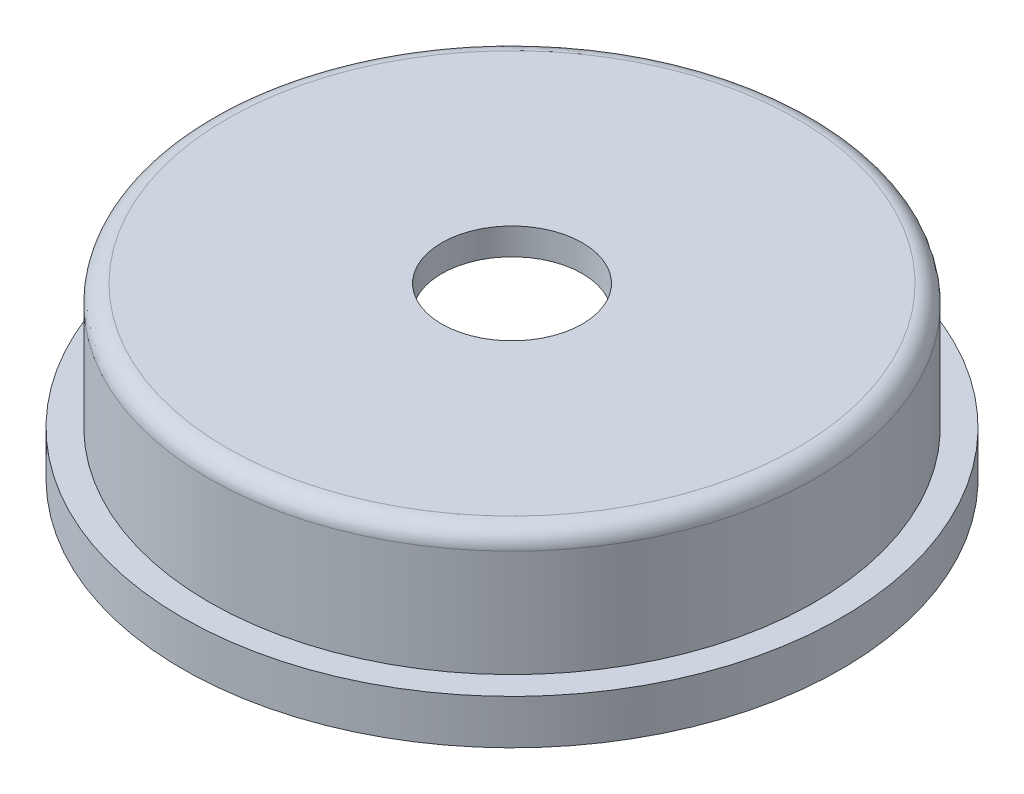
from build123d import *
from build123d.topology import SkipClean

# Parameters (mm, degrees)
SKETCH_1_R          = 18.5
EXTRUDE_1_DEPTH     = 20
SKETCH_2_R          = 16
CUT_EXTRUDE_1_DEPTH = 6.5
SKETCH_3_R          = 3.95
CUT_EXTRUDE_2_DEPTH = 7
SKETCH_4_R          = 3
CUT_EXTRUDE_3_DEPTH = 17
SKETCH_5_R          = 25.146051565
SKETCH_5_R_2        = 17
CUT_EXTRUDE_4_DEPTH = 19
CUT_EXTRUDE_5_DEPTH = 12
FILLET_5_R          = 1
FILLET_7_R          = 2
CUT_EXTRUDE_6_REACH = 34.932
SKETCH_9_R          = 5.408326913
SKETCH_9_R_2        = 4.5
FILLET_8_R          = 0.8
EXTRUDE_START       = 1.5
SKETCH_10_R         = 18.5
SKETCH_10_R_2       = 16
EXTRUDE_2_DEPTH     = 1.5
SKETCH_11_R         = 16
CUT_EXTRUDE_7_DEPTH = 29.783675929


with BuildPart() as part:
    # 草图1 → 凸台-拉伸1 (new body)
    with BuildSketch(Plane(origin=(0, 0, 0), x_dir=(1, 0, 0), z_dir=(0, 1, 0))):
        with Locations(Location((0, 0, 0), (0, 0, 270))):
            Circle(SKETCH_1_R)
    extrude(amount=EXTRUDE_1_DEPTH)

    # 草图2 → 切除-拉伸1 (cut)
    with BuildSketch(Plane.XZ):
        with Locations(Location((0, 0, 0), (0, 0, 270))):
            Circle(SKETCH_2_R)
    extrude(amount=-CUT_EXTRUDE_1_DEPTH, mode=Mode.SUBTRACT)

    # 草图3 → 切除-拉伸2 (cut)
    with BuildSketch(Plane.XZ.offset(-6.5)):
        with Locations(Location((0, 0, 0), (0, 0, 270))):
            Circle(SKETCH_3_R)
    extrude(amount=-CUT_EXTRUDE_2_DEPTH, mode=Mode.SUBTRACT)

    # 草图4 → 切除-拉伸3 (cut)
    with BuildSketch(Plane.XZ.offset(-13.5)):
        with Locations(Location((0, 0, 0), (0, 0, 270))):
            Circle(SKETCH_4_R)
    extrude(amount=-CUT_EXTRUDE_3_DEPTH, mode=Mode.SUBTRACT)

    # 草图5 → 切除-拉伸4 (cut)
    with BuildSketch(Plane(origin=(0, 20, 0), x_dir=(1, 0, 0), z_dir=(0, 1, 0))):
        Circle(SKETCH_5_R)
        with Locations(Location((0, 0, 0), (0, 0, 270))):
            Circle(SKETCH_5_R_2, mode=Mode.SUBTRACT)
    extrude(amount=-CUT_EXTRUDE_4_DEPTH, mode=Mode.SUBTRACT)

    # 草图6 → 切除-拉伸5 (cut)
    with BuildSketch(Plane(origin=(0, 20, 0), x_dir=(1, 0, 0), z_dir=(0, 1, 0))):
        with BuildLine():
            Line((-1, 15.467708298), (-1, 5.408326913))
            ThreePointArc((-1, 5.408326913), (-3.889087297, 3.889087297), (-5.408326913, 1))
            Line((-5.408326913, 1), (-15.467708298, 1))
            ThreePointArc((-15.467708298, 1), (-10.960155108, 10.960155108), (-1, 15.467708298))
        make_face()
        with BuildLine():
            Line((1, 15.467708298), (1, 5.408326913))
            ThreePointArc((1, 5.408326913), (3.889087297, 3.889087297), (5.408326913, 1))
            Line((5.408326913, 1), (15.467708298, 1))
            ThreePointArc((15.467708298, 1), (10.960155108, 10.960155108), (1, 15.467708298))
        make_face()
        with BuildLine():
            Line((-15.467708298, -1), (-5.408326913, -1))
            ThreePointArc((-5.408326913, -1), (-3.889087297, -3.889087297), (-1, -5.408326913))
            Line((-1, -5.408326913), (-1, -15.467708298))
            ThreePointArc((-1, -15.467708298), (-10.960155108, -10.960155108), (-15.467708298, -1))
        make_face()
        with BuildLine():
            Line((1, -5.408326913), (1, -15.467708298))
            ThreePointArc((1, -15.467708298), (10.960155108, -10.960155108), (15.467708298, -1))
            Line((15.467708298, -1), (5.408326913, -1))
            ThreePointArc((5.408326913, -1), (3.889087297, -3.889087297), (1, -5.408326913))
        make_face()
    extrude(amount=-CUT_EXTRUDE_5_DEPTH, mode=Mode.SUBTRACT)

    # 草图8 → 切除-旋转2 (revolve, cut)
    with BuildSketch(Plane.XY, mode=Mode.PRIVATE) as cut_revolve_2_sk:
        Polygon((-19.272016982, 8), (-19.272016982, 20.821833332), (-5.408326913, 20.821833332), (-5.408326913, 16), (-15, 8), (-17, 8), align=None)
    revolve(cut_revolve_2_sk.sketch.rotate(Axis((0, 13.5, 0), (0, -1, 0)), 270), axis=Axis((0, 13.5, 0), (0, -1, 0)), mode=Mode.SUBTRACT)

    # 圆角5
    fillet_5_edges = [part.edges().sort_by_distance(p)[0] for p in [
        (0, 8, -17),
    ]]
    fillet(fillet_5_edges, radius=FILLET_5_R)

    # 圆角7
    fillet_7_edges = [part.edges().sort_by_distance(p)[0] for p in [
        (-1, 11.96176972, 5.408326913),
        (-5.408326913, 11.96176972, 1),
        (-5.408326913, 11.96176972, -1),
        (-1, 11.96176972, -5.408326913),
        (1, 11.96176972, -5.408326913),
        (5.408326913, 11.96176972, -1),
        (5.408326913, 11.96176972, 1),
        (1, 11.96176972, 5.408326913),
    ]]
    fillet(fillet_7_edges, radius=FILLET_7_R)

    # 切除-拉伸6: up to this cone (the profile starts outside it)
    with SkipClean():  # the faces are left unmerged after this step: merging them gives an invalid solid
        cut_extrude_6_end = Plane(origin=(0, 20, 0), z_dir=(0, -1, 0)).offset(-0.510850748) * Cone(1.199e-06, 43.828361396, 36.555341117, align=(Align.CENTER, Align.CENTER, Align.MIN), mode=Mode.PRIVATE)
        # 草图9 → 切除-拉伸6 (cut, up to the surface)
        with BuildSketch(Plane(origin=(0, 20, 0), x_dir=(1, 0, 0), z_dir=(0, 1, 0)), mode=Mode.PRIVATE) as cut_extrude_6_sk1:
            Circle(SKETCH_9_R)
            with Locations(Location((0, 0, 0), (0, 0, 270))):
                Circle(SKETCH_9_R_2, mode=Mode.SUBTRACT)
        cut_extrude_6_tool1 = extrude(cut_extrude_6_sk1.sketch, amount=-CUT_EXTRUDE_6_REACH, mode=Mode.PRIVATE) - cut_extrude_6_end
        add(cut_extrude_6_tool1.solids().sort_by_distance((-5.255356, 20, 0))[0], mode=Mode.SUBTRACT)

    # 圆角8
    fillet_8_edges = [part.edges().sort_by_distance(p)[0] for p in [
        (0, 20, -4.5),
    ]]
    fillet(fillet_8_edges, radius=FILLET_8_R)

    # 草图10 → 凸台-拉伸2 (add)
    with SkipClean():  # the faces are left unmerged after this step: merging them gives an invalid solid
        with BuildSketch(Plane.XZ.offset(EXTRUDE_START)):
            with Locations(Location((0, 0, 0), (0, 0, 270))):
                Circle(SKETCH_10_R)
            with Locations(Location((0, 0, 0), (0, 0, 270))):
                Circle(SKETCH_10_R_2, mode=Mode.SUBTRACT)
        extrude(amount=-EXTRUDE_2_DEPTH)

    # 草图11 → 切除-拉伸7 (cut, through all)
    with BuildSketch(Plane(origin=(0, 8, 0), x_dir=(1, 0, 0), z_dir=(0, 1, 0))):
        with Locations(Location((0, 0, 0), (0, 0, 90))):
            Circle(SKETCH_11_R)
    extrude(amount=CUT_EXTRUDE_7_DEPTH, mode=Mode.SUBTRACT)


solid = part.part
